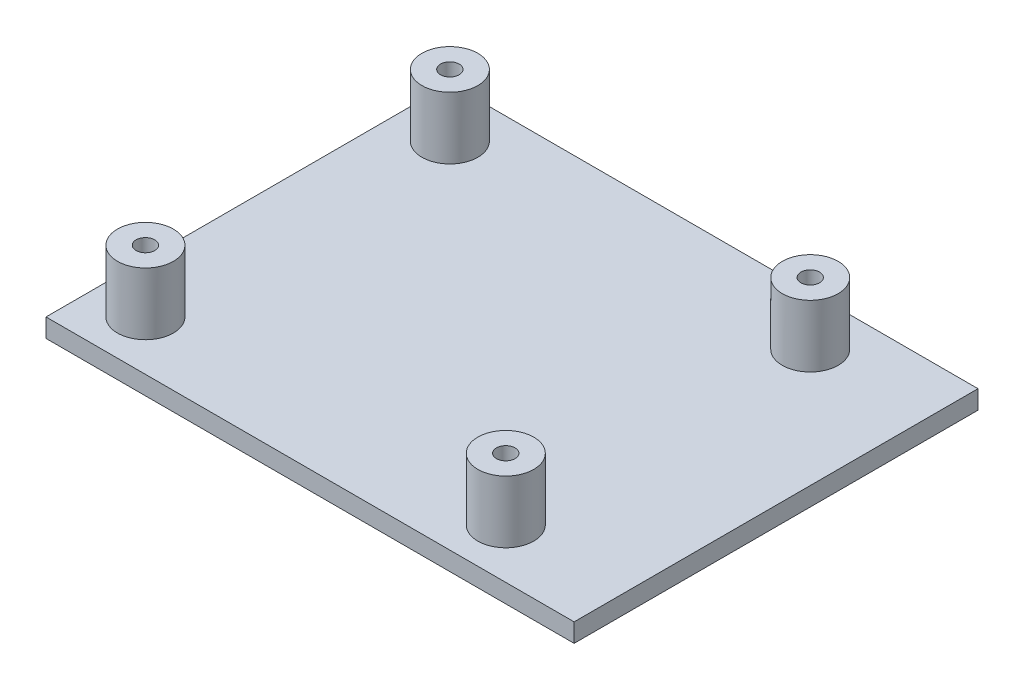
from build123d import *

# Parameters (mm, degrees)
SKETCH2_R             = 4.5
SKETCH2_R_2           = 1.5
BOSS_EXTRUDE1_DEPTH   = 10
BOSS_EXTRUDE1_2_DEPTH = 10
BOSS_EXTRUDE1_3_DEPTH = 10
BOSS_EXTRUDE1_4_DEPTH = 10
SKETCH3_W             = 85
SKETCH3_H             = 65
BOSS_EXTRUDE2_DEPTH   = 3


with BuildPart() as part:
    # Sketch2 → Boss-Extrude1 (new body)
    with BuildSketch(Plane(origin=(0, 0, 0), x_dir=(1, 0, 0), z_dir=(0, 1, 0))):
        with Locations(Location((66, 8, 0), (0, 0, 270))):
            Circle(SKETCH2_R)
        with Locations(Location((66, 8, 0), (0, 0, 270))):
            Circle(SKETCH2_R_2, mode=Mode.SUBTRACT)
    extrude(amount=BOSS_EXTRUDE1_DEPTH)



with BuildPart() as body_2:
    # Sketch2 → Boss-Extrude1 2 (new body)
    with BuildSketch(Plane(origin=(0, 0, 0), x_dir=(1, 0, 0), z_dir=(0, 1, 0))):
        with Locations(Location((66, 57, 0), (0, 0, 270))):
            Circle(SKETCH2_R)
        with Locations(Location((66, 57, 0), (0, 0, 270))):
            Circle(SKETCH2_R_2, mode=Mode.SUBTRACT)
    extrude(amount=BOSS_EXTRUDE1_2_DEPTH)


with BuildPart() as body_3:
    # Sketch2 → Boss-Extrude1 3 (new body)
    with BuildSketch(Plane(origin=(0, 0, 0), x_dir=(1, 0, 0), z_dir=(0, 1, 0))):
        with Locations(Location((8, 57, 0), (0, 0, 270))):
            Circle(SKETCH2_R)
        with Locations(Location((8, 57, 0), (0, 0, 270))):
            Circle(SKETCH2_R_2, mode=Mode.SUBTRACT)
    extrude(amount=BOSS_EXTRUDE1_3_DEPTH)


with BuildPart() as body_4:
    # Sketch2 → Boss-Extrude1 4 (new body)
    with BuildSketch(Plane(origin=(0, 0, 0), x_dir=(1, 0, 0), z_dir=(0, 1, 0))):
        with Locations(Location((8, 8, 0), (0, 0, 270))):
            Circle(SKETCH2_R)
        with Locations(Location((8, 8, 0), (0, 0, 270))):
            Circle(SKETCH2_R_2, mode=Mode.SUBTRACT)
    extrude(amount=BOSS_EXTRUDE1_4_DEPTH)


with BuildPart() as part_1:
    add(part.part)

    add(body_2.part)  # Boss-Extrude2 merges body 2

    add(body_3.part)  # Boss-Extrude2 merges body 3

    add(body_4.part)  # Boss-Extrude2 merges body 4
    # Sketch3 → Boss-Extrude2 (add)
    with BuildSketch(Plane(origin=(0, 0, 0), x_dir=(1, 0, 0), z_dir=(0, 1, 0))):
        with Locations((42.5, 32.5)):
            Rectangle(SKETCH3_W, SKETCH3_H)
    extrude(amount=-BOSS_EXTRUDE2_DEPTH)


solid = part_1.part
